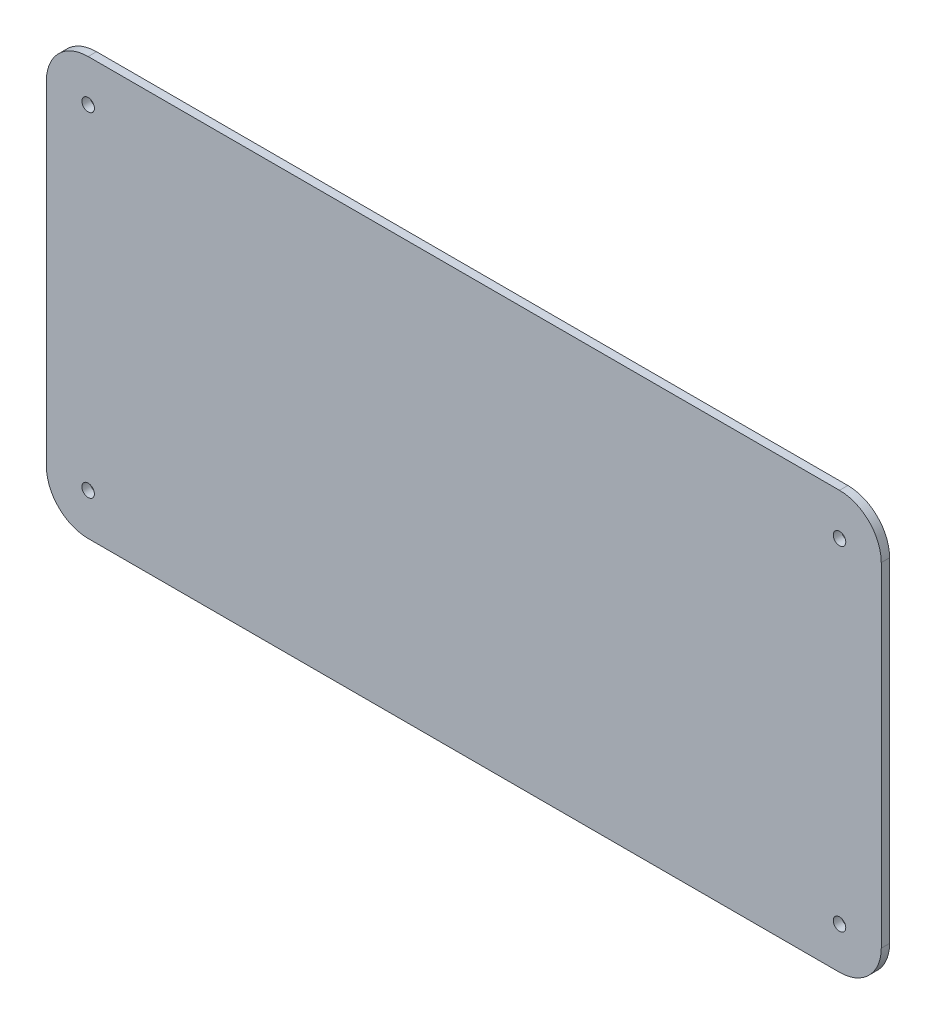
from build123d import *

# Parameters (mm, degrees)
SKETCH1_R           = 1.5
BOSS_EXTRUDE1_DEPTH = 2


with BuildPart() as part:
    # Sketch1 → Boss-Extrude1 (new body)
    with BuildSketch(Plane.XY):
        with BuildLine():
            Line((-108.52070268, 55.759093245), (-108.52070268, 27.009093245))
            Line((-108.52070268, 27.009093245), (-108.52070268, 4.509093245))
            Line((-108.52070268, 4.509093245), (-108.52070268, -24.240906755))
            ThreePointArc((-108.52070268, -24.240906755), (-105.591770492, -31.311974567), (-98.52070268, -34.240906755))
            Line((-98.52070268, -34.240906755), (81.474525228, -34.240906755))
            ThreePointArc((81.474525228, -34.240906755), (88.545593039, -31.311974567), (91.474525228, -24.240906755))
            Line((91.474525228, -24.240906755), (91.474525228, 4.509093245))
            Line((91.474525228, 4.509093245), (91.474525228, 27.009093245))
            Line((91.474525228, 27.009093245), (91.474525228, 55.759093245))
            ThreePointArc((91.474525228, 55.759093245), (88.545593039, 62.830161056), (81.474525228, 65.759093245))
            Line((81.474525228, 65.759093245), (-98.52070268, 65.759093245))
            ThreePointArc((-98.52070268, 65.759093245), (-105.591770492, 62.830161056), (-108.52070268, 55.759093245))
        make_face()
        with Locations((-98.52070268, 55.759093245)):
            Circle(SKETCH1_R, mode=Mode.SUBTRACT)
        with Locations((-98.52070268, -24.240906755)):
            Circle(SKETCH1_R, mode=Mode.SUBTRACT)
        with Locations((81.474525228, -24.240906755)):
            Circle(SKETCH1_R, mode=Mode.SUBTRACT)
        with Locations((81.474525228, 55.759093245)):
            Circle(SKETCH1_R, mode=Mode.SUBTRACT)
    extrude(amount=BOSS_EXTRUDE1_DEPTH)


solid = part.part
